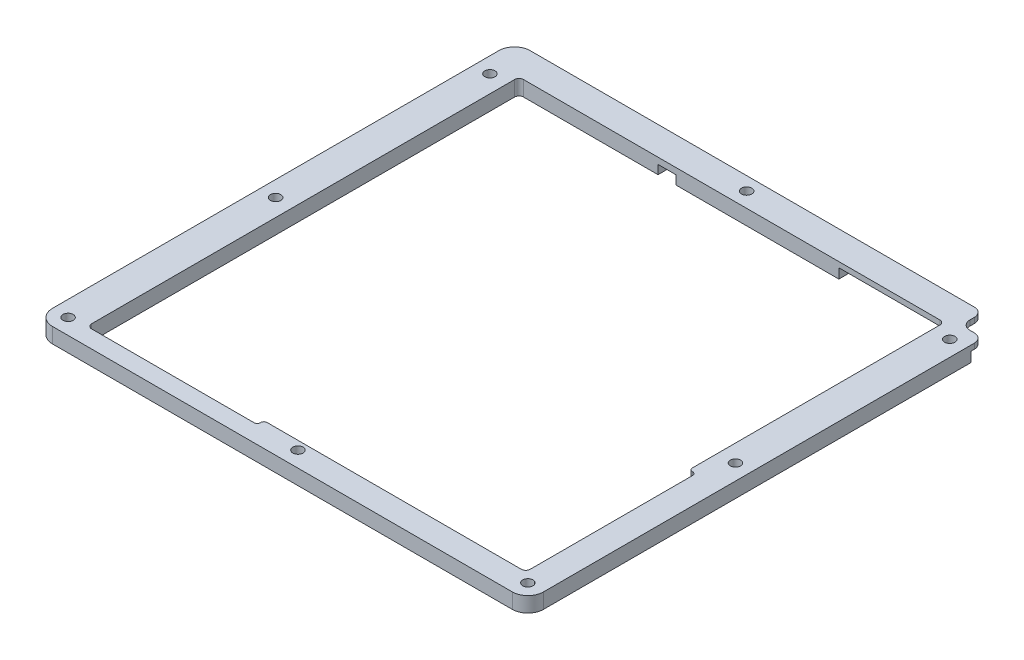
from build123d import *
from build123d.topology import SkipClean

# Parameters (mm, degrees)
SKETCH_2_R           = 1.15
EXTRUDE_1_DEPTH      = 3.4
CUT_EXTRUDE_4_DEPTH  = 155.193255365
SKETCH_5_W           = 10.5
SKETCH_5_H           = 2.7
SKETCH_5_W_2         = 4
SKETCH_5_H_2         = 2.5
SKETCH_5_W_3         = 3
SKETCH_5_H_3         = 2
CUT_EXTRUDE_8_DEPTH  = 2
SKETCH_6_W           = 1
SKETCH_6_H           = 1
CUT_EXTRUDE_9_DEPTH  = 2
SKETCH_7_W           = 0.375
SKETCH_7_H           = 4.5
EXTRUDE_2_DEPTH      = 2
SKETCH_8_W           = 110
SKETCH_8_H           = 3.4
CUT_EXTRUDE_10_DEPTH = 1
SKETCH_9_W           = 6
SKETCH_9_H           = 2.5
SKETCH_9_W_2         = 6.621572964
EXTRUDE_3_DEPTH      = 3.4
FILLET_1_R           = 3.5
SKETCH_10_W          = 5
SKETCH_10_H          = 5
CUT_EXTRUDE_11_DEPTH = 155.193255365
FILLET_4_R           = 2
FILLET_5_R           = 2
SKETCH_11_R          = 1.15
CUT_EXTRUDE_12_DEPTH = 11
SKETCH_12_W          = 23.625
SKETCH_12_H          = 7.35
CUT_EXTRUDE_14_DEPTH = 2
SKETCH_14_W          = 31
SKETCH_14_H          = 12
CUT_EXTRUDE_15_DEPTH = 2.2
EXTRUDE_START        = 2.2
SKETCH_15_R          = 1.15
EXTRUDE_8_DEPTH      = 2.2


with BuildPart() as part:
    # 스케치2 → 보스-돌출1 (new body)
    with BuildSketch(Plane(origin=(0, 0, 0), x_dir=(1, 0, 0), z_dir=(0, 1, 0))):
        with BuildLine():
            Line((3.5, 0), (106.5, 0))
            ThreePointArc((106.5, 0), (108.974873734, -1.025126266), (110, -3.5))
            Line((110, -3.5), (110, -104.5))
            ThreePointArc((110, -104.5), (108.974873734, -106.974873734), (106.5, -108))
            Line((106.5, -108), (3.5, -108))
            ThreePointArc((3.5, -108), (1.025126266, -106.974873734), (0, -104.5))
            Line((0, -104.5), (0, -3.5))
            ThreePointArc((0, -3.5), (1.025126266, -1.025126266), (3.5, 0))
        make_face()
        with Locations(Location((3.5, -104.5, 0), (0, 0, 270))):
            Circle(SKETCH_2_R, mode=Mode.SUBTRACT)
        with Locations(Location((106.5, -10, 0), (0, 0, 270))):
            Circle(SKETCH_2_R, mode=Mode.SUBTRACT)
        with Locations(Location((106.5, -104.5, 0), (0, 0, 270))):
            Circle(SKETCH_2_R, mode=Mode.SUBTRACT)
        with Locations(Location((55, -104.5, 0), (0, 0, 270))):
            Circle(SKETCH_2_R, mode=Mode.SUBTRACT)
        with Locations(Location((3.5, -10, 0), (0, 0, 270))):
            Circle(SKETCH_2_R, mode=Mode.SUBTRACT)
        with Locations(Location((55, -4, 0), (0, 0, 270))):
            Circle(SKETCH_2_R, mode=Mode.SUBTRACT)
    extrude(amount=EXTRUDE_1_DEPTH)

    # 스케치3 → 컷-돌출4 (cut, through all)
    with BuildSketch(Plane(origin=(0, 3.4, 0), x_dir=(1, 0, 0), z_dir=(0, 1, 0))):
        with BuildLine():
            Line((7.375, -8.35), (7.375, -103.100597342))
            ThreePointArc((7.375, -103.100597342), (7.667893219, -103.807704123), (8.375, -104.100597342))
            Line((8.375, -104.100597342), (44.775, -104.100597342))
            ThreePointArc((44.775, -104.100597342), (45.269974747, -103.895572089), (45.475, -103.400597342))
            Line((45.475, -103.400597342), (45.475, -103.3))
            ThreePointArc((45.475, -103.3), (45.680025253, -102.805025253), (46.175, -102.6))
            Line((46.175, -102.6), (102.625, -102.6))
            Line((102.625, -102.6), (103.125, -102.6))
            ThreePointArc((103.125, -102.6), (103.832106781, -102.307106781), (104.125, -101.6))
            Line((104.125, -101.6), (104.125, -65.2))
            ThreePointArc((104.125, -65.2), (103.919974747, -64.705025253), (103.425, -64.5))
            Line((103.425, -64.5), (103.325, -64.5))
            ThreePointArc((103.325, -64.5), (102.830025253, -64.294974747), (102.625, -63.8))
            Line((102.625, -63.8), (102.625, -8.35))
            ThreePointArc((102.625, -8.35), (102.332106781, -7.642893219), (101.625, -7.35))
            Line((101.625, -7.35), (8.375, -7.35))
            ThreePointArc((8.375, -7.35), (7.667893219, -7.642893219), (7.375, -8.35))
        make_face()
    extrude(amount=-CUT_EXTRUDE_4_DEPTH, mode=Mode.SUBTRACT)

    # 스케치5 → 컷-돌출8 (cut)
    with BuildSketch(Plane.XZ):
        Polygon((101.625, 7.35), (97, 7.35), (97, 2.85), (103, 2.85), (103, 7.35), (102.625, 7.35), align=None)
        with BuildLine():
            Line((97, 8.636748981), (97, 7.35))
            Line((97, 7.35), (101.625, 7.35))
            ThreePointArc((101.625, 7.35), (102.332106781, 7.642893219), (102.625, 8.35))
            Line((102.625, 8.35), (102.625, 8.636748981))
            Line((102.625, 8.636748981), (97, 8.636748981))
        make_face()
        with BuildLine():
            ThreePointArc((0, 3.5), (1.025126266, 1.025126266), (3.5, 0))
            Line((3.5, 0), (6, 0))
            Line((6, 0), (6, 6))
            Line((6, 6), (0, 6))
            Line((0, 6), (0, 3.5))
        make_face()
        with Locations((46.25, 1.35)):
            Rectangle(SKETCH_5_W, SKETCH_5_H)
        with Locations((40.5, 6.1)):
            Rectangle(SKETCH_5_W_2, SKETCH_5_H_2)
        with Locations((21, 1)):
            Rectangle(SKETCH_5_W_3, SKETCH_5_H_3)
        with Locations((59, 1.25)):
            Rectangle(SKETCH_5_W_2, SKETCH_5_H_2)
        with Locations((80.5, 1)):
            Rectangle(SKETCH_5_W_3, SKETCH_5_H_3)
    extrude(amount=-CUT_EXTRUDE_8_DEPTH, mode=Mode.SUBTRACT)

    # 스케치6 → 컷-돌출9 (cut)
    with BuildSketch(Plane.XZ):
        with Locations((102.125, 7.85)):
            Rectangle(SKETCH_6_W, SKETCH_6_H)
    extrude(amount=-CUT_EXTRUDE_9_DEPTH, mode=Mode.SUBTRACT)

    # 스케치7 → 보스-돌출2 (add)
    with BuildSketch(Plane.XZ.offset(-2)):
        with Locations((102.8125, 5.1)):
            Rectangle(SKETCH_7_W, SKETCH_7_H)
    extrude(amount=EXTRUDE_2_DEPTH)

    # 스케치8 → 컷-돌출10 (cut)
    with BuildSketch(Plane(origin=(0, 0, 0), x_dir=(-1, 0, 0), z_dir=(0, 0, -1))):
        with Locations((-55, 1.7)):
            Rectangle(SKETCH_8_W, SKETCH_8_H)
    extrude(amount=-CUT_EXTRUDE_10_DEPTH, mode=Mode.SUBTRACT)

    # 스케치9 → 보스-돌출3 (add, through all)
    with BuildSketch(Plane.XZ):
        with Locations((3, 2.25)):
            Rectangle(SKETCH_9_W, SKETCH_9_H)
        with Locations((106.689213518, 2.25)):
            Rectangle(SKETCH_9_W_2, SKETCH_9_H)
    extrude(amount=-EXTRUDE_3_DEPTH)

    # 필렛1
    fillet_1_edges = [part.edges().sort_by_distance(p)[0] for p in [
        (0, 1.7, 1),
        (110, 1.7, 1),
    ]]
    fillet(fillet_1_edges, radius=FILLET_1_R)

    # 스케치10 → 컷-돌출11 (cut, through all)
    with BuildSketch(Plane.XZ):
        with Locations((107.5, 3.5)):
            Rectangle(SKETCH_10_W, SKETCH_10_H)
    extrude(amount=-CUT_EXTRUDE_11_DEPTH, mode=Mode.SUBTRACT)

    # 필렛4
    fillet_4_edges = [part.edges().sort_by_distance(p)[0] for p in [
        (110, 1.7, 6),
        (105, 1.7, 1),
    ]]
    fillet(fillet_4_edges, radius=FILLET_4_R)

    # 필렛5
    fillet_5_edges = [part.edges().sort_by_distance(p)[0] for p in [
        (105, 1.7, 6),
    ]]
    fillet(fillet_5_edges, radius=FILLET_5_R)

    # 스케치11 → 컷-돌출12 (cut)
    with BuildSketch(Plane(origin=(0, 3.4, 0), x_dir=(1, 0, 0), z_dir=(0, 1, 0))):
        with Locations(Location((3.5, -58, 0), (0, 0, 270))):
            Circle(SKETCH_11_R)
        with Locations(Location((106.5, -58, 0), (0, 0, 270))):
            Circle(SKETCH_11_R)
    extrude(amount=-CUT_EXTRUDE_12_DEPTH, mode=Mode.SUBTRACT)

    # 스케치12 → 컷-돌출14 (cut)
    with BuildSketch(Plane.XZ):
        with Locations((90.8125, 4.675)):
            Rectangle(SKETCH_12_W, SKETCH_12_H)
    extrude(amount=-CUT_EXTRUDE_14_DEPTH, mode=Mode.SUBTRACT)

    # 스케치14 → 컷-돌출15 (cut)
    with BuildSketch(Plane.XZ):
        with Locations((94.5, 7)):
            Rectangle(SKETCH_14_W, SKETCH_14_H)
    extrude(amount=-CUT_EXTRUDE_15_DEPTH, mode=Mode.SUBTRACT)

    # 스케치15 → 보스-돌출8 (add)
    with SkipClean():  # the faces are left unmerged after this step: merging them gives an invalid solid
        with BuildSketch(Plane.XZ.offset(-2.2).offset(EXTRUDE_START)):
            with BuildLine():
                Line((110, 13), (102.625, 13))
                Line((102.625, 13), (102.625, 8.7))
                Line((102.625, 8.7), (105.567262095, 8.7))
                ThreePointArc((105.567262095, 8.7), (106.5, 8.4), (107.432737905, 8.7))
                Line((107.432737905, 8.7), (110, 8.7))
                Line((110, 8.7), (110, 13))
            make_face()
            with Locations(Location((106.5, 10, 0), (0, 0, 270))):
                Circle(SKETCH_15_R, mode=Mode.SUBTRACT)
        extrude(amount=-EXTRUDE_8_DEPTH)


solid = part.part
